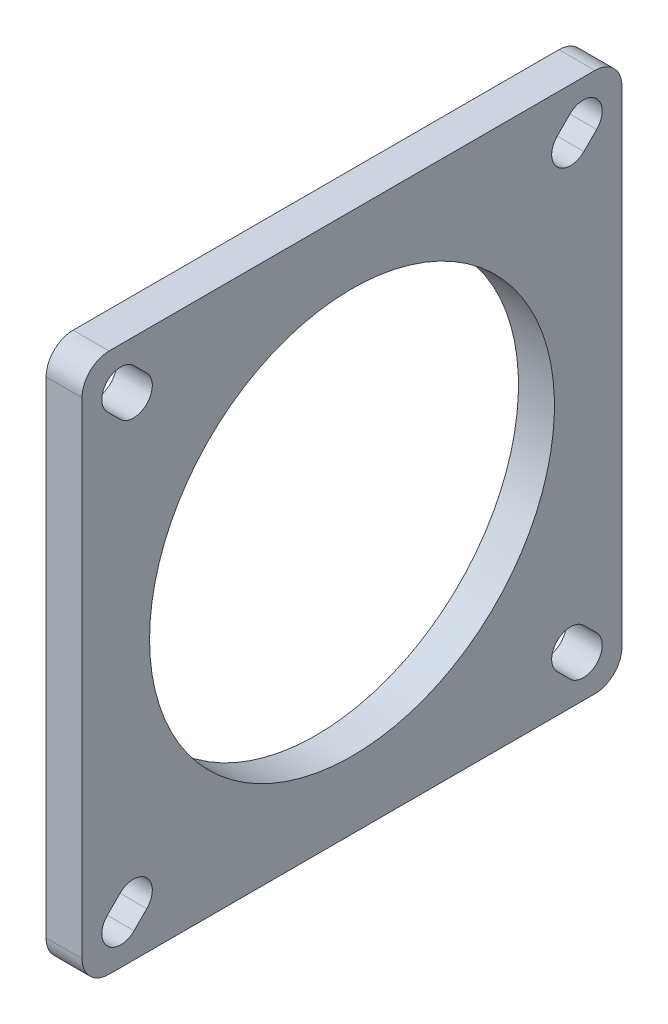
from build123d import *

# Parameters (mm, degrees)
SKETCH_1_W               = 4
SKETCH_1_H               = 27.5
CUT_EXTRUDE_4_DEPTH      = 71.823724839
CUT_EXTRUDE_4_DEPTH_BACK = 71.823724839
SKETCH_7_R               = 50
SKETCH_7_W               = 60
SKETCH_7_H               = 60
CUT_EXTRUDE_3_DEPTH      = 43.614551505
PATTERN_CIRCULAR_2_COUNT = 4
FILLET_1_R               = 3


with BuildPart() as part:
    # Эскиз1 → Повернуть1 (revolve)
    with BuildSketch(Plane.XY, mode=Mode.PRIVATE) as revolve_1_sk:
        with Locations((2, 36.25)):
            Rectangle(SKETCH_1_W, SKETCH_1_H)
    revolve(revolve_1_sk.sketch.rotate(Axis((-29.36512031, 0, 0), (1, 0, 0)), 90), axis=Axis((-29.36512031, 0, 0), (1, 0, 0)))

    # Эскиз7 → Вырез-Вытянуть4 (cut, two sides: drawn at the far end of the back side and taken through both)
    with BuildSketch(Plane.ZY.offset(-CUT_EXTRUDE_4_DEPTH_BACK)):
        Circle(SKETCH_7_R)
        Rectangle(SKETCH_7_W, SKETCH_7_H, mode=Mode.SUBTRACT)
    extrude(amount=CUT_EXTRUDE_4_DEPTH + CUT_EXTRUDE_4_DEPTH_BACK, mode=Mode.SUBTRACT)

    # Эскиз6 → Вырез-Вытянуть3 (cut, symmetric)
    with BuildSketch(Plane.ZY):
        with BuildLine():
            Line((-27.192031022, 24.222182541), (-25.777817459, 22.807968978))
            ThreePointArc((-25.777817459, 22.807968978), (-22.807968978, 22.807968978), (-22.807968978, 25.777817459))
            Line((-22.807968978, 25.777817459), (-24.222182541, 27.192031022))
            ThreePointArc((-24.222182541, 27.192031022), (-27.192031022, 27.192031022), (-27.192031022, 24.222182541))
        make_face()
    cut_extrude_3 = extrude(amount=CUT_EXTRUDE_3_DEPTH, both=True, mode=Mode.SUBTRACT)

    # Круговой массив2: Вырез-Вытянуть3 ×4 about axis
    pattern_circular_2_axis = Axis((0, 0, 0), (1, 0, 0))
    for i in range(1, PATTERN_CIRCULAR_2_COUNT):
        add(cut_extrude_3.rotate(pattern_circular_2_axis, i * 360 / PATTERN_CIRCULAR_2_COUNT), mode=Mode.SUBTRACT)

    # Скругление1
    fillet_1_edges = [part.edges().sort_by_distance(p)[0] for p in [
        (2, 30, -30),
        (2, 30, 30),
        (2, -30, 30),
        (2, -30, -30),
    ]]
    fillet(fillet_1_edges, radius=FILLET_1_R)


solid = part.part
